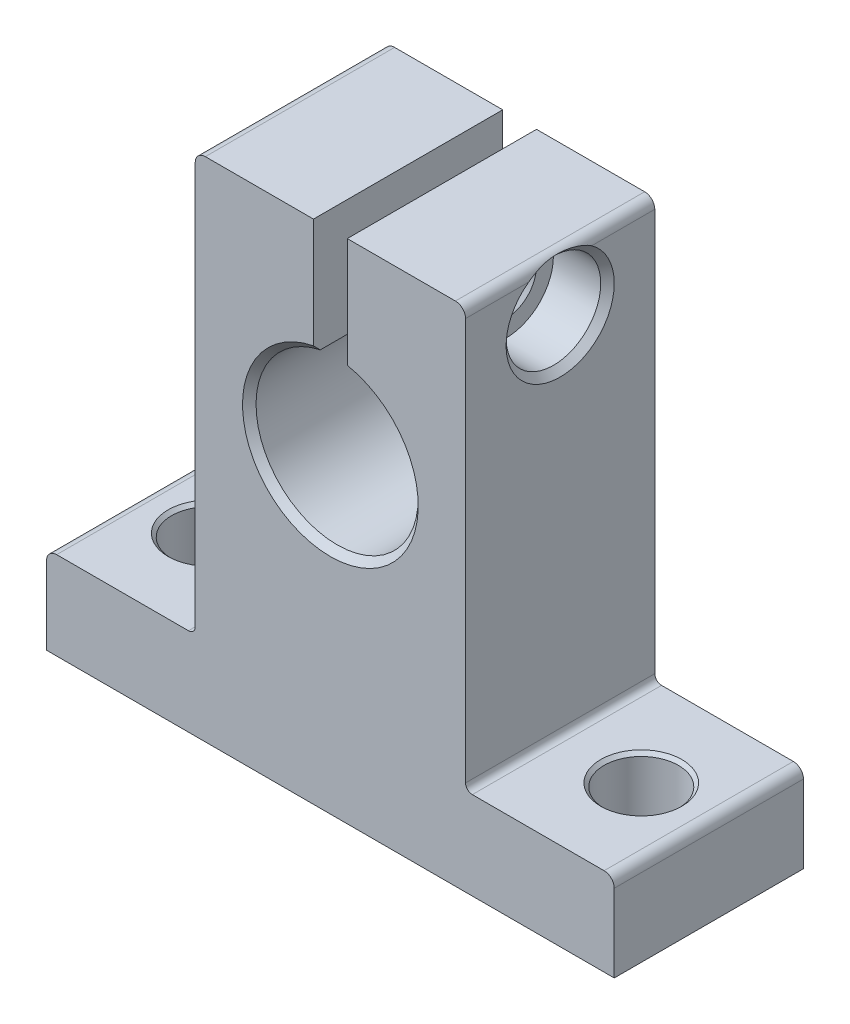
from build123d import *
from OCP.BRepFilletAPI import BRepFilletAPI_MakeFillet

# Parameters (mm, degrees)
BOSS_EXTRUDE1_DEPTH                 = 7
F_5_5_5_5_DIAMETER_HOLE2_AT_2_COUNT = 2
F_5_5_5_5_DIAMETER_HOLE2_AT_2_PITCH = 32
M3_5X0_6_TAPPED_HOLE1_D             = 2.9
M3_5X0_6_TAPPED_HOLE1_DEPTH         = 8.75
FILLET1_R1                          = 0.75
FILLET1_R2                          = 0.5
CHAMFER1_SIZE                       = 0.5


with BuildPart() as part:
    # Sketch2 → Boss-Extrude1 (new, symmetric)
    with BuildSketch(Plane.XY):
        with BuildLine():
            Line((-21, -16.5), (-10, -16.5))
            Line((-10, -16.5), (-10, 14.5))
            Line((-10, 14.5), (-1.25, 14.5))
            Line((-1.25, 14.5), (-1.25, 5.868347297))
            ThreePointArc((-1.25, 5.868347297), (0, -6), (1.25, 5.868347297))
            Line((1.25, 5.868347297), (1.25, 14.5))
            Line((1.25, 14.5), (10, 14.5))
            Line((10, 14.5), (10, -16.5))
            Line((10, -16.5), (21, -16.5))
            Line((21, -16.5), (21, -23))
            Line((21, -23), (-21, -23))
            Line((-21, -23), (-21, -16.5))
        make_face()
    extrude(amount=BOSS_EXTRUDE1_DEPTH, both=True)

    # Sketch5 → Ø5.5 (5.5) Diameter Hole2 (revolve, cut)
    with BuildSketch(Plane(origin=(-16, -16.5, 0), x_dir=(0, 0, 1), z_dir=(1, 0, 0))):
        Polygon((0, 0), (0, 6.5), (3, 6.5), (2.75, 6.25), (2.75, 0.25), (3, 0), align=None)
    f_5_5_5_5_diameter_hole2 = revolve(axis=Axis((-16, -10.15, 0), (0, -1, 0)), mode=Mode.SUBTRACT)

    # Ø5.5 (5.5) Diameter Hole2 at 2: Ø5.5 (5.5) Diameter Hole2 ×2
    with Locations(*[(i * F_5_5_5_5_DIAMETER_HOLE2_AT_2_PITCH, 0, 0) for i in range(1, F_5_5_5_5_DIAMETER_HOLE2_AT_2_COUNT)]):
        add(f_5_5_5_5_diameter_hole2, mode=Mode.SUBTRACT)

    # M3.5x0.6 Tapped Hole1
    with Locations(Plane.ZY.offset(10)):
        with Locations((0, 10.5)):
            Hole(M3_5X0_6_TAPPED_HOLE1_D / 2, depth=M3_5X0_6_TAPPED_HOLE1_DEPTH)

    # Fillet1: one fillet with a radius per group of edges: ONE call of the kernel's fillet builder (fillet() takes one radius for all edges)
    fillet1_edges_1 = [part.edges().sort_by_distance(p)[0] for p in [
        (10, 14.5, 0),
        (-10, 14.5, 0),
        (21, -16.5, 0),
        (-21, -16.5, 0),
    ]]
    fillet1_edges_2 = [part.edges().sort_by_distance(p)[0] for p in [
        (10, -16.5, 0),
        (-10, -16.5, 0),
    ]]
    fillet1 = BRepFilletAPI_MakeFillet(part.part.solid().wrapped)
    for e in fillet1_edges_1:
        fillet1.Add(FILLET1_R1, e.wrapped)
    for e in fillet1_edges_2:
        fillet1.Add(FILLET1_R2, e.wrapped)
    add(Compound.cast(fillet1.Shape()), mode=Mode.REPLACE)

    # Sketch12 → CBORE for M5 Hex Head Bolt1 (revolve, cut)
    with BuildSketch(Plane(origin=(10, 10.5, 0), x_dir=(0, 0, -1), z_dir=(0, 1, 0))):
        Polygon((0, 0), (0, 8.75), (2, 8.75), (2, 4.25), (2.25, 4), (3.5, 4), (3.5, 0.5), (4, 0), align=None)
    revolve(axis=Axis((16.35, 10.5, 0), (-1, 0, 0)), mode=Mode.SUBTRACT)

    # Chamfer1
    chamfer1_edges = [part.edges().sort_by_distance(p)[0] for p in [
        (0, -6, 7),
        (0, -6, -7),
    ]]
    chamfer(chamfer1_edges, length=CHAMFER1_SIZE)


solid = part.part
